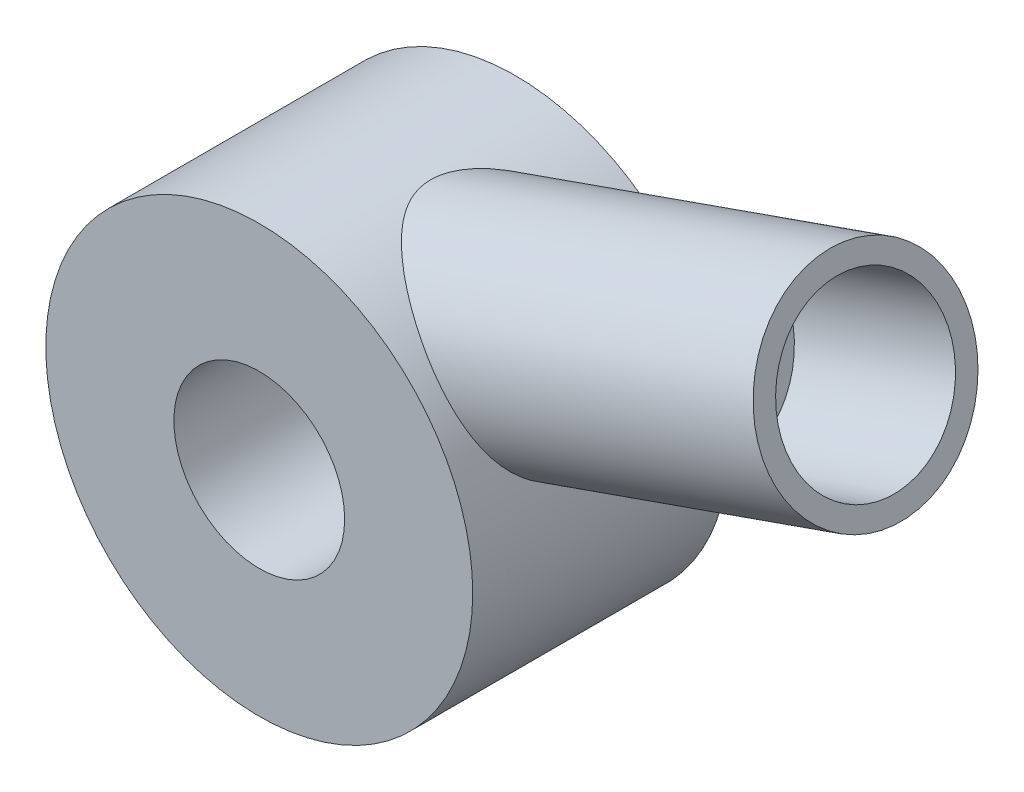
from build123d import *
from build123d.topology import SkipClean

# Parameters (mm, degrees)
SKETCH1_R               = 63.5
BOSS_EXTRUDE1_DEPTH     = 76.2
SKETCH2_R               = 25.4
CUT_EXTRUDE1_DEPTH      = 38.1
BOSS_EXTRUDE2_START     = -76.2
BOSS_EXTRUDE2_DEPTH     = 76.2
CUT_EXTRUDE2_REACH      = 256.508
CUT_EXTRUDE2_END_RADIUS = 63.5
SKETCH4_W               = 81.28
SKETCH4_H               = 81.144088403
SKETCH4_R               = 31.75
SKETCH5_R               = 25.4
CUT_EXTRUDE3_DEPTH      = 50.8


with BuildPart() as part:
    # Sketch1 → Boss-Extrude1 (new body)
    with BuildSketch(Plane.XY):
        with Locations(Location((0, 0, 0), (0, 0, 180))):
            Circle(SKETCH1_R)
    extrude(amount=BOSS_EXTRUDE1_DEPTH)

    # Sketch2 → Cut-Extrude1 (cut)
    with BuildSketch(Plane.XY.offset(76.2)):
        Circle(SKETCH2_R)
    extrude(amount=-CUT_EXTRUDE1_DEPTH, mode=Mode.SUBTRACT)

    # Sketch3 → Boss-Extrude2 (add)
    with BuildSketch(Plane.XY.offset(76.2).offset(BOSS_EXTRUDE2_START)):
        with BuildLine():
            Line((0, 63.5), (129.649672122, 109.864270226))
            Line((129.649672122, 109.864270226), (154.869718929, 38.102896329))
            Line((154.869718929, 38.102896329), (138.756562943, 32.195085674))
            Line((138.756562943, 32.195085674), (63.286235532, 5.205995792))
            ThreePointArc((63.286235532, 5.205995792), (43.02132766, 46.705624569), (0, 63.5))
        make_face()
    extrude(amount=BOSS_EXTRUDE2_DEPTH)

    # Cut-Extrude2: up to this cylinder (the profile starts outside it)
    with SkipClean():  # the faces are left unmerged after this step: merging them gives an invalid solid
        cut_extrude2_end = Plane(origin=(0, 0, 77.591488), z_dir=(0, 0, -1)) * Cylinder(CUT_EXTRUDE2_END_RADIUS, 641.016, mode=Mode.PRIVATE)
        # Sketch4 → Cut-Extrude2 (cut, up to the surface)
        with BuildSketch(Plane(origin=(149.763130669, 52.633233734, 0), x_dir=(0, 0, -1), z_dir=(0.9434330365890324, 0.3315631244158456, 0)), mode=Mode.PRIVATE) as cut_extrude2_sk1:
            with Locations((-38.1, 22.630487503)):
                Rectangle(SKETCH4_W, SKETCH4_H)
            with Locations(Location((-38.1, 22.630487502, 0), (0, 0, 90))):
                Circle(SKETCH4_R, mode=Mode.SUBTRACT)
        cut_extrude2_tool1 = extrude(cut_extrude2_sk1.sketch, amount=-CUT_EXTRUDE2_REACH, mode=Mode.PRIVATE) - cut_extrude2_end
        add(cut_extrude2_tool1.solids().sort_by_distance((142.259696, 73.983583, 77.591488))[0], mode=Mode.SUBTRACT)

    # Sketch5 → Cut-Extrude3 (cut)
    with SkipClean():  # the faces are left unmerged after this step: merging them gives an invalid solid
        with BuildSketch(Plane(origin=(149.763130669, 52.633233734, 0), x_dir=(0, 0, -1), z_dir=(0.9434330365890324, 0.3315631244158456, 0))):
            with Locations(Location((-38.1, 22.630487502, 0), (0, 0, 90))):
                Circle(SKETCH5_R)
        extrude(amount=-CUT_EXTRUDE3_DEPTH, mode=Mode.SUBTRACT)


solid = part.part
